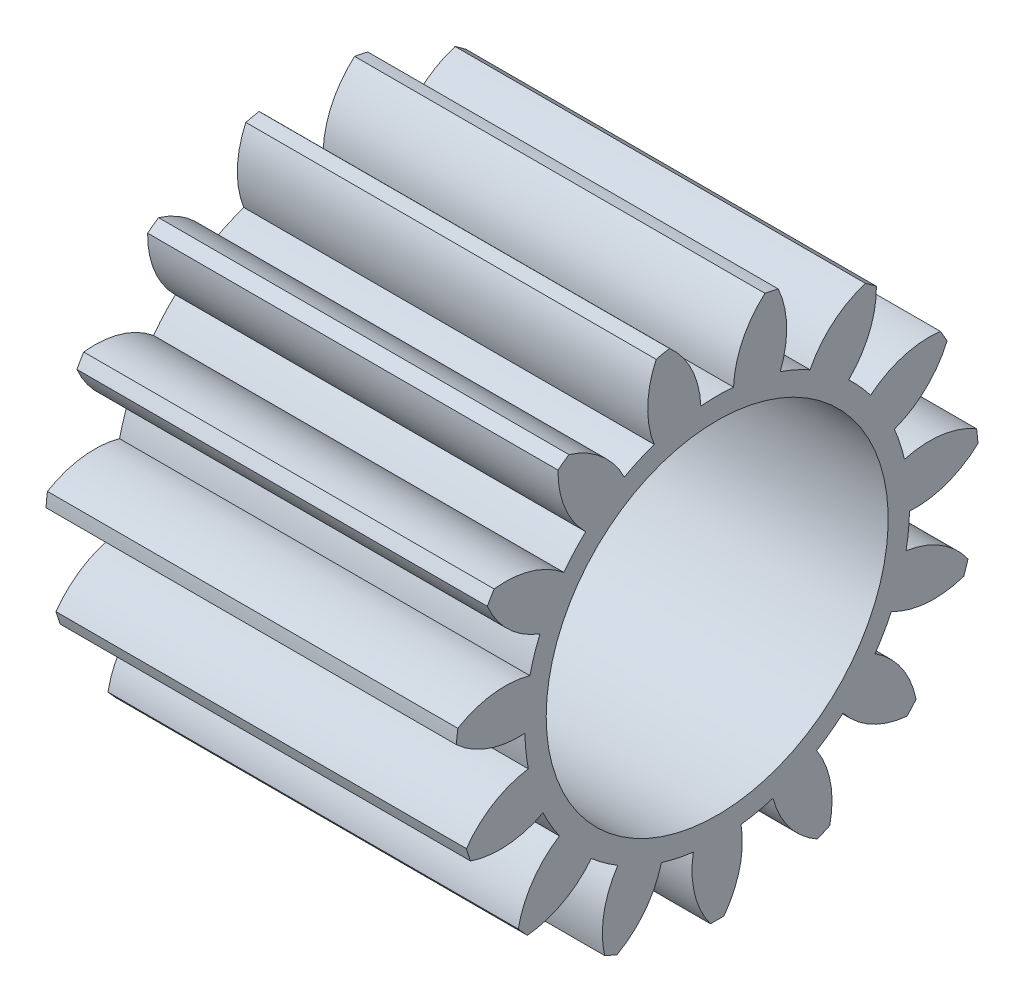
from build123d import *

# Parameters (mm, degrees)
BASPROSKE_W     = 12
BASPROSKE_H     = 7.65
TOOTHCUT_DEPTH  = 17.156887076
TEETHCUTS_COUNT = 15
TEETHCUTS_ANGLE = 336
BORSKE_R        = 5
BORE_DEPTH      = 50.0000508


with BuildPart() as part:
    # BasProSke → Base-Revolve (revolve)
    with BuildSketch(Plane(origin=(0, 0, 0), x_dir=(1, 0, 0), z_dir=(0, 1, 0)), mode=Mode.PRIVATE) as base_revolve_sk:
        with Locations((6, 3.825)):
            Rectangle(BASPROSKE_W, BASPROSKE_H)
    revolve(base_revolve_sk.sketch.rotate(Axis((-10, 0, 0), (1, 0, 0)), 180), axis=Axis((-10, 0, 0), (1, 0, 0)))

    # TooCutSke → ToothCut (cut, through all)
    with BuildSketch(Plane(origin=(0, 0, 0), x_dir=(0, 0, -1), z_dir=(1, 0, 0))):
        with BuildLine():
            ThreePointArc((0.478122431, 5.603639437), (0, 5.624), (-0.478122431, 5.603639437))
            ThreePointArc((-0.478122431, 5.603639437), (-0.747614045, 6.671381253), (-1.421029562, 7.542707746))
            ThreePointArc((-1.421029562, 7.542707746), (0, 7.6754), (1.421029562, 7.542707746))
            ThreePointArc((1.421029562, 7.542707746), (0.747614045, 6.671381253), (0.478122431, 5.603639437))
        make_face()
    toothcut = extrude(amount=TOOTHCUT_DEPTH, mode=Mode.SUBTRACT)

    # TeethCuts: ToothCut ×15 about axis
    teethcuts_axis = Axis((-10, 0, 0), (1, 0, 0))
    for i in range(1, TEETHCUTS_COUNT):
        add(toothcut.rotate(teethcuts_axis, i * TEETHCUTS_ANGLE / (TEETHCUTS_COUNT - 1)), mode=Mode.SUBTRACT)

    # BorSke → Bore (cut, symmetric)
    with BuildSketch(Plane(origin=(0, 0, 0), x_dir=(0, 0, -1), z_dir=(1, 0, 0))):
        with Locations(Location((0, 0, 0), (0, 0, 180))):
            Circle(BORSKE_R)
    extrude(amount=BORE_DEPTH, both=True, mode=Mode.SUBTRACT)


solid = part.part
